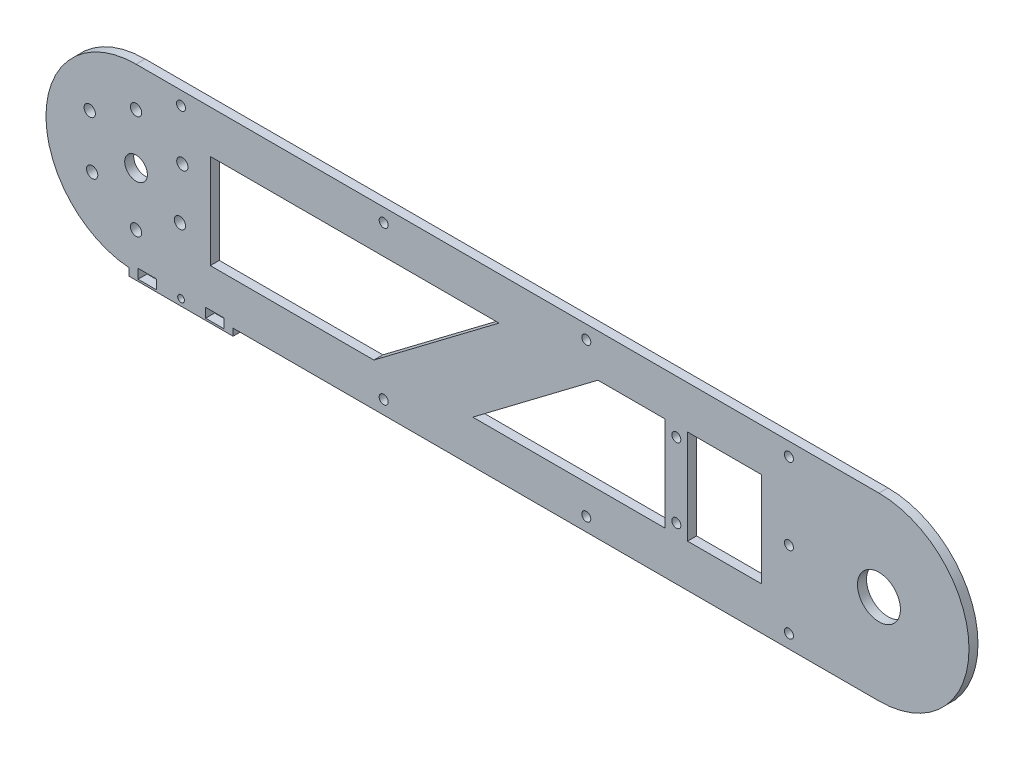
from build123d import *

# Parameters (mm, degrees)
SKETCH_1_R          = 2.5
SKETCH_1_R_2        = 5.03
SKETCH_1_R_3        = 2
SKETCH_1_R_4        = 9.53
EXTRUDE_1_DEPTH     = 4
SKETCH_3_W          = 46.2
SKETCH_3_H          = 3.817212264
EXTRUDE_2_DEPTH     = 4
SKETCH_2_R          = 2
SKETCH_2_R_2        = 1.5
SKETCH_2_W          = 32.809844138
SKETCH_2_H          = 42
SKETCH_2_W_2        = 8.2
SKETCH_2_H_2        = 4.2
CUT_EXTRUDE_1_DEPTH = 4


with BuildPart() as part:
    # 草图1 → 凸台-拉伸1 (new body)
    with BuildSketch(Plane.XY):
        with BuildLine():
            ThreePointArc((-1.457142857, 39.854285714), (-41.457142857, -0.145714286), (-1.457142857, -40.145714286))
            Line((-1.457142857, -40.145714286), (328.542857143, -40.145714286))
            ThreePointArc((328.542857143, -40.145714286), (368.542857143, -0.145714286), (328.542857143, 39.854285714))
            Line((328.542857143, 39.854285714), (-1.457142857, 39.854285714))
        make_face()
        with Locations((-1.457142857, -23.895714286)):
            Circle(SKETCH_1_R, mode=Mode.SUBTRACT)
        with Locations((-20.942714442, -11.395714286)):
            Circle(SKETCH_1_R, mode=Mode.SUBTRACT)
        with Locations((18.028428728, -11.395714286)):
            Circle(SKETCH_1_R, mode=Mode.SUBTRACT)
        with Locations((-1.457142857, -0.145714286)):
            Circle(SKETCH_1_R_2, mode=Mode.SUBTRACT)
        with Locations((238.542857143, -16.645714286)):
            Circle(SKETCH_1_R_3, mode=Mode.SUBTRACT)
        with Locations((288.542857143, -0.145714286)):
            Circle(SKETCH_1_R_3, mode=Mode.SUBTRACT)
        with Locations((328.542857143, -0.145714286)):
            Circle(SKETCH_1_R_4, mode=Mode.SUBTRACT)
        with Locations((-22.025246197, 11.729285714)):
            Circle(SKETCH_1_R, mode=Mode.SUBTRACT)
        with Locations((19.110960483, 11.729285714)):
            Circle(SKETCH_1_R, mode=Mode.SUBTRACT)
        with Locations((-1.457142857, 22.354285714)):
            Circle(SKETCH_1_R, mode=Mode.SUBTRACT)
        with Locations((238.542857143, 16.354285714)):
            Circle(SKETCH_1_R_3, mode=Mode.SUBTRACT)
    extrude(amount=EXTRUDE_1_DEPTH)

    # 草图3 → 凸台-拉伸2 (add)
    with BuildSketch(Plane.XY.offset(4)):
        with Locations((18.542857143, -41.36131722)):
            Rectangle(SKETCH_3_W, SKETCH_3_H)
    extrude(amount=-EXTRUDE_2_DEPTH)

    # 草图2 → 切除-拉伸1 (cut)
    with BuildSketch(Plane.XY.offset(4)):
        with Locations((18.542857143, 33.854285714)):
            Circle(SKETCH_2_R)
        with Locations((108.542857143, 33.854285714)):
            Circle(SKETCH_2_R)
        with Locations((198.542857143, 33.854285714)):
            Circle(SKETCH_2_R)
        with Locations((288.542857143, 33.854285714)):
            Circle(SKETCH_2_R)
        with Locations((108.542857143, -34.145714286)):
            Circle(SKETCH_2_R)
        with Locations((198.542857143, -34.145714286)):
            Circle(SKETCH_2_R)
        with Locations((288.542857143, -34.145714286)):
            Circle(SKETCH_2_R)
        with Locations((18.542857143, -40.329923352)):
            Circle(SKETCH_2_R_2)
        Polygon((31.542857143, -21.145714286), (104.183898028, -21.145714286), (159.772133322, 20.854285714), (31.542857143, 20.854285714), align=None)
        Polygon((148.123425102, -21.145714286), (203.711660396, 20.854285714), (233.542857143, 20.854285714), (233.542857143, -21.145714286), align=None)
        with Locations((259.947779212, -0.145714286)):
            Rectangle(SKETCH_2_W, SKETCH_2_H)
        with Locations((33.542857143, -40.329923352)):
            Rectangle(SKETCH_2_W_2, SKETCH_2_H_2)
        with Locations((3.542857143, -40.329923352)):
            Rectangle(SKETCH_2_W_2, SKETCH_2_H_2)
    extrude(amount=-CUT_EXTRUDE_1_DEPTH, mode=Mode.SUBTRACT)


solid = part.part
